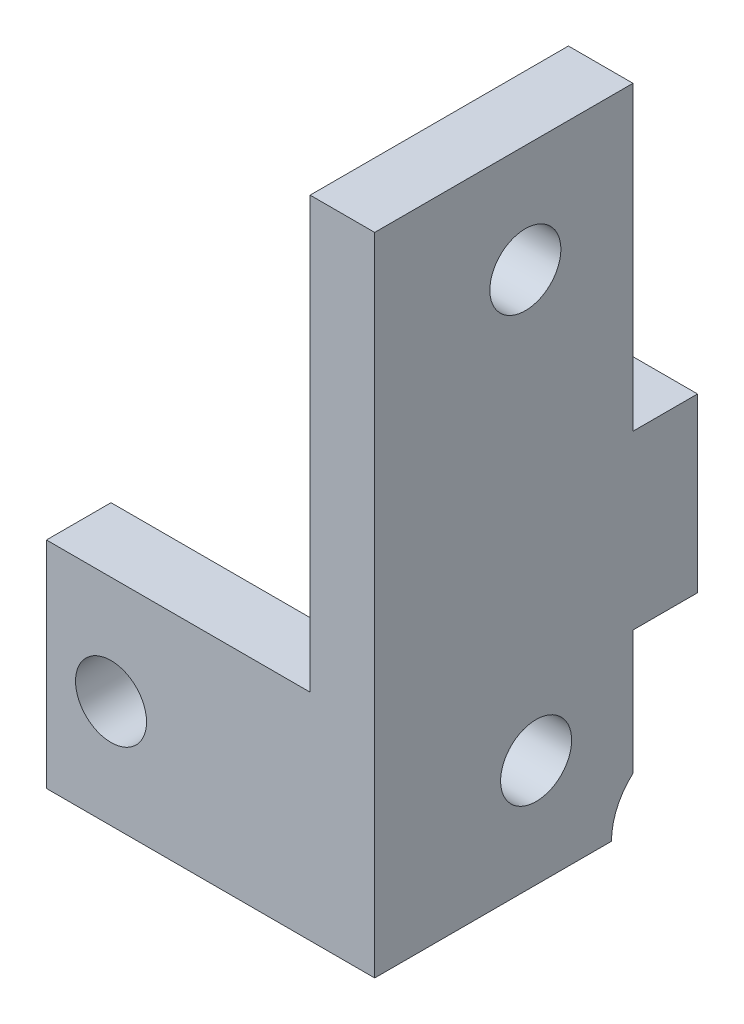
from build123d import *

# Parameters (mm, degrees)
SKETCH_1_W          = 12.25
SKETCH_1_H          = 10
SKETCH_1_R          = 1.65
EXTRUDE_3_DEPTH     = 3
SKETCH_3_W          = 3
SKETCH_3_H          = 10
EXTRUDE_4_DEPTH     = 14
SKETCH_4_R          = 1.65
CUT_EXTRUDE_1_DEPTH = 10
SKETCH_6_W          = 14
SKETCH_6_H          = 20
SKETCH_6_R          = 1.65
EXTRUDE_5_DEPTH     = 3
CUT_EXTRUDE_2_DEPTH = 3
CUT_EXTRUDE_3_REACH = 33.282
SKETCH_8_W          = 2
SKETCH_8_H          = 27.763932023
SKETCH_9_W          = 3
SKETCH_9_H          = 8
EXTRUDE_6_DEPTH     = 15


with BuildPart() as part:
    # 草图1 → 凸台-拉伸3 (new body)
    with BuildSketch(Plane.XY):
        with Locations((3.125, 0)):
            Rectangle(SKETCH_1_W, SKETCH_1_H)
        Circle(SKETCH_1_R, mode=Mode.SUBTRACT)
    extrude(amount=EXTRUDE_3_DEPTH)

    # 草图3 → 凸台-拉伸4 (add)
    with BuildSketch(Plane.XY.offset(3)):
        with Locations((10.75, 0)):
            Rectangle(SKETCH_3_W, SKETCH_3_H)
    extrude(amount=-EXTRUDE_4_DEPTH)

    # 草图4 → 切除-拉伸1 (cut)
    with BuildSketch(Plane(origin=(12.25, 0, 0), x_dir=(0, 0, -1), z_dir=(1, 0, 0))):
        with Locations(Location((4.5, 0, 0), (0, 0, 90))):
            Circle(SKETCH_4_R)
    extrude(amount=-CUT_EXTRUDE_1_DEPTH, mode=Mode.SUBTRACT)

    # 草图6 → 凸台-拉伸5 (add)
    with BuildSketch(Plane(origin=(12.25, 0, 0), x_dir=(0, 0, -1), z_dir=(1, 0, 0))):
        with Locations((4, 15)):
            Rectangle(SKETCH_6_W, SKETCH_6_H)
        with Locations(Location((4, 20, 0), (0, 0, 90))):
            Circle(SKETCH_6_R, mode=Mode.SUBTRACT)
    extrude(amount=-EXTRUDE_5_DEPTH)

    # 草图7 → 切除-拉伸2 (cut)
    with BuildSketch(Plane(origin=(12.25, 0, 0), x_dir=(0, 0, -1), z_dir=(1, 0, 0))):
        with BuildLine():
            Line((8, -5), (11, -5))
            Line((11, -5), (11, -2))
            ThreePointArc((11, -2), (8.878679656, -2.878679656), (8, -5))
        make_face()
    extrude(amount=-CUT_EXTRUDE_2_DEPTH, mode=Mode.SUBTRACT)

    # 草图8 → 切除-拉伸3 (cut, up to next)
    with BuildSketch(Plane(origin=(12.25, 0, 0), x_dir=(0, 0, -1), z_dir=(1, 0, 0)), mode=Mode.PRIVATE) as cut_extrude_3_sk1:
        with Locations((10, 11.118033989)):
            Rectangle(SKETCH_8_W, SKETCH_8_H)
    cut_extrude_3_tool1 = extrude(cut_extrude_3_sk1.sketch, amount=-CUT_EXTRUDE_3_REACH, mode=Mode.PRIVATE) & part.part
    add(cut_extrude_3_tool1.solids().sort_by_distance((12.25, 11.118034, -10))[0], mode=Mode.SUBTRACT)

    # 草图9 → 凸台-拉伸6 (add)
    with BuildSketch(Plane(origin=(12.25, 0, 0), x_dir=(0, 0, -1), z_dir=(1, 0, 0))):
        with Locations((10.5, 7)):
            Rectangle(SKETCH_9_W, SKETCH_9_H)
    extrude(amount=-EXTRUDE_6_DEPTH)


solid = part.part
